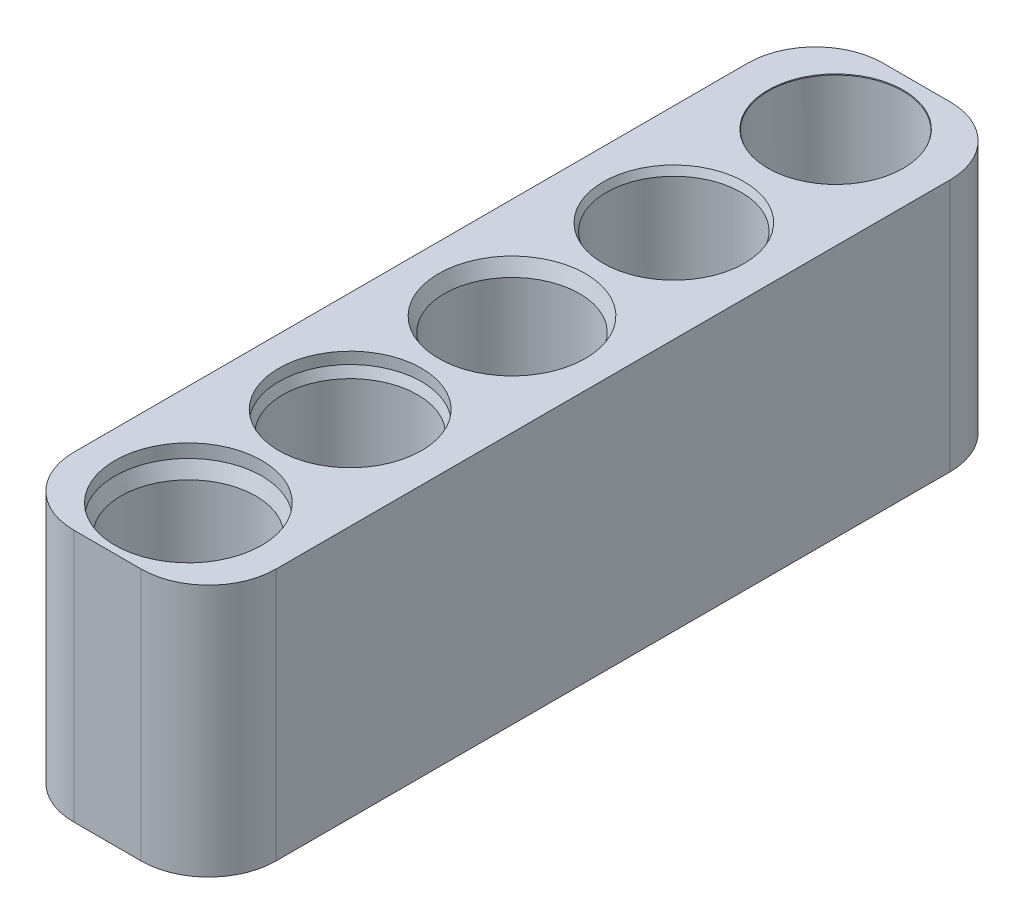
from build123d import *

# Parameters (mm, degrees)
BOSS_EXTRUDE1_DEPTH      = 60
BOSS_EXTRUDE1_DEPTH_BACK = 60
SKETCH2_W                = 30
SKETCH2_H                = 37.5
FILLET1_R                = 10


with BuildPart() as part:
    # Sketch1 → Revolve1 (revolve)
    with BuildSketch(Plane(origin=(0, 0, 0), x_dir=(0, 0, -1), z_dir=(1, 0, 0))):
        Polygon((0, 40.5), (0, 0), (10, 12), (10, 38.387755102), (10.9, 40.5), (10.9, 42.5), (0, 42.5), align=None)
    revolve(axis=Axis((0, 0, 0), (0, 1, 0)))


with BuildPart() as body_2:
    # Sketch1<3> → Revolve2 (revolve)
    with BuildSketch(Plane(origin=(0, 0, 0), x_dir=(0, 0, -1), z_dir=(1, 0, 0))):
        Polygon((24, 41.5), (24, 1), (34, 13), (34, 39.387755102), (35.207308332, 42.221233841), (35.207308332, 42.5), (24, 42.5), align=None)
    revolve(axis=Axis((0, 1, -24), (0, 1, 0)))


with BuildPart() as body_3:
    # Sketch1<4> → Revolve3 (revolve)
    with BuildSketch(Plane(origin=(0, 0, 0), x_dir=(0, 0, -1), z_dir=(1, 0, 0))):
        Polygon((48, 42.5), (48, 2), (58, 14), (58, 40.387755102), (58.9, 42.5), align=None)
    revolve(axis=Axis((0, 2, -48), (0, 1, 0)))


with BuildPart() as body_4:
    # Sketch1<5> → Revolve4 (revolve)
    with BuildSketch(Plane(origin=(0, 0, 0), x_dir=(0, 0, -1), z_dir=(1, 0, 0))):
        Polygon((-24, 39.501916964), (-24, -0.998083036), (-14, 11.001916964), (-14, 37.389672066), (-13.407308332, 38.780683123), (-13.407308332, 42.5), (-24, 42.5), align=None)
    revolve(axis=Axis((0, -0.998083036, 24), (0, 1, 0)))


with BuildPart() as body_5:
    # Sketch1<6> → Revolve5 (revolve)
    with BuildSketch(Plane(origin=(0, 0, 0), x_dir=(0, 0, -1), z_dir=(1, 0, 0))):
        Polygon((-48, 38.503833927), (-48, -1.996166073), (-38, 10.003833927), (-38, 36.391589029), (-37.1, 38.503833927), (-37.1, 42.5), (-48, 42.5), align=None)
    revolve(axis=Axis((0, -1.996166073, 48), (0, 1, 0)))


with BuildPart() as body_6:
    # Sketch2 → Boss-Extrude1 (new, two sides: drawn at the far end of the back side and taken through both)
    with BuildSketch(Plane.XY.offset(-BOSS_EXTRUDE1_DEPTH_BACK)):
        with Locations((0, 21.75)):
            Rectangle(SKETCH2_W, SKETCH2_H)
    extrude(amount=BOSS_EXTRUDE1_DEPTH + BOSS_EXTRUDE1_DEPTH_BACK)

    # Combine1: cut part, body 5, body 2, body 3, body 4
    add(part.part, mode=Mode.SUBTRACT)
    add(body_5.part, mode=Mode.SUBTRACT)
    add(body_2.part, mode=Mode.SUBTRACT)
    add(body_3.part, mode=Mode.SUBTRACT)
    add(body_4.part, mode=Mode.SUBTRACT)

    # Fillet1
    fillet1_edges = [body_6.edges().sort_by_distance(p)[0] for p in [
        (-15, 21.75, -60),
        (15, 21.75, -60),
        (15, 21.75, 60),
        (-15, 21.75, 60),
    ]]
    fillet(fillet1_edges, radius=FILLET1_R)


solid = body_6.part
